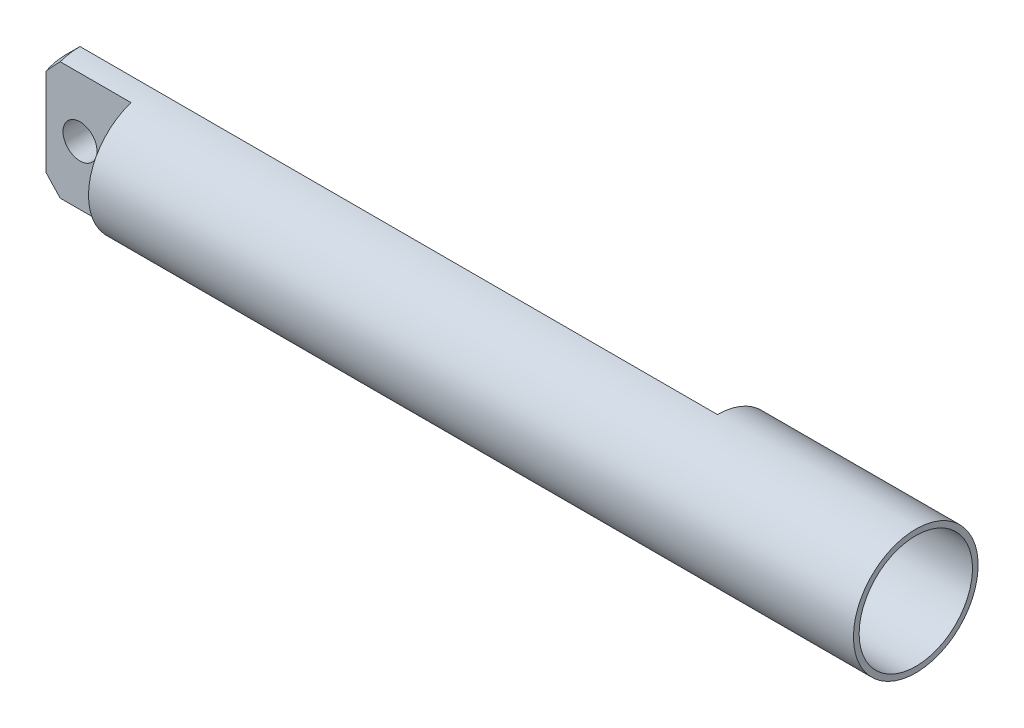
from build123d import *

# Parameters (mm, degrees)
CHANFREIN1_SIZE         = 5
ESQUISSE2_W             = 62.305459945
ESQUISSE2_H             = 30.289532294
ENL_V_MAT_EXTRU_1_DEPTH = 25
ENL_V_MAT_EXTRU_2_REACH = 304.2
ESQUISSE3_R             = 6
ESQUISSE4_W             = 39.235751697
ESQUISSE4_H             = 28.135609998
ENL_V_MAT_EXTRU_3_DEPTH = 230


with BuildPart() as part:
    # Esquisse1 → Révolution1 (revolve)
    with BuildSketch(Plane(origin=(0, 0, 0), x_dir=(1, 0, 0), z_dir=(0, 1, 0)), mode=Mode.PRIVATE) as r_volution1_sk:
        Polygon((0, 0), (0, 22), (300, 22), (300, 20), (40, 20), (40, 0), align=None)
    revolve(r_volution1_sk.sketch.rotate(Axis((0, 0, 0), (1, 0, 0)), 180), axis=Axis((0, 0, 0), (1, 0, 0)))

    # Chanfrein1
    chanfrein1_edges = [part.edges().sort_by_distance(p)[0] for p in [
        (0, 0, -22),
    ]]
    chamfer(chanfrein1_edges, length=CHANFREIN1_SIZE)

    # Esquisse2 → Enlèv. mat.-Extru.1 (cut, symmetric)
    with BuildSketch(Plane(origin=(0, 0, 0), x_dir=(1, 0, 0), z_dir=(0, 1, 0))):
        with Locations((-1.152729972, 22.144766147)):
            Rectangle(ESQUISSE2_W, ESQUISSE2_H)
        with Locations((-1.152729972, -22.144766147)):
            Rectangle(ESQUISSE2_W, ESQUISSE2_H)
    extrude(amount=ENL_V_MAT_EXTRU_1_DEPTH, both=True, mode=Mode.SUBTRACT)

    # Esquisse3 → Enlèv. mat.-Extru.2 (cut, up to next)
    with BuildSketch(Plane(origin=(0, 0, -7), x_dir=(-1, 0, 0), z_dir=(0, 0, -1)), mode=Mode.PRIVATE) as enl_v_mat_extru_2_sk1:
        with Locations((-12, 0)):
            Circle(ESQUISSE3_R)
    enl_v_mat_extru_2_tool1 = extrude(enl_v_mat_extru_2_sk1.sketch, amount=-ENL_V_MAT_EXTRU_2_REACH, mode=Mode.PRIVATE) & part.part
    add(enl_v_mat_extru_2_tool1.solids().sort_by_distance((12, 0, -7))[0], mode=Mode.SUBTRACT)

    # Esquisse4 → Enlèv. mat.-Extru.3 (cut)
    with BuildSketch(Plane(origin=(0, 0, 0), x_dir=(0, 0, -1), z_dir=(1, 0, 0))):
        with Locations((19.617875849, 14.067804999)):
            Rectangle(ESQUISSE4_W, ESQUISSE4_H)
    extrude(amount=ENL_V_MAT_EXTRU_3_DEPTH, mode=Mode.SUBTRACT)


solid = part.part
